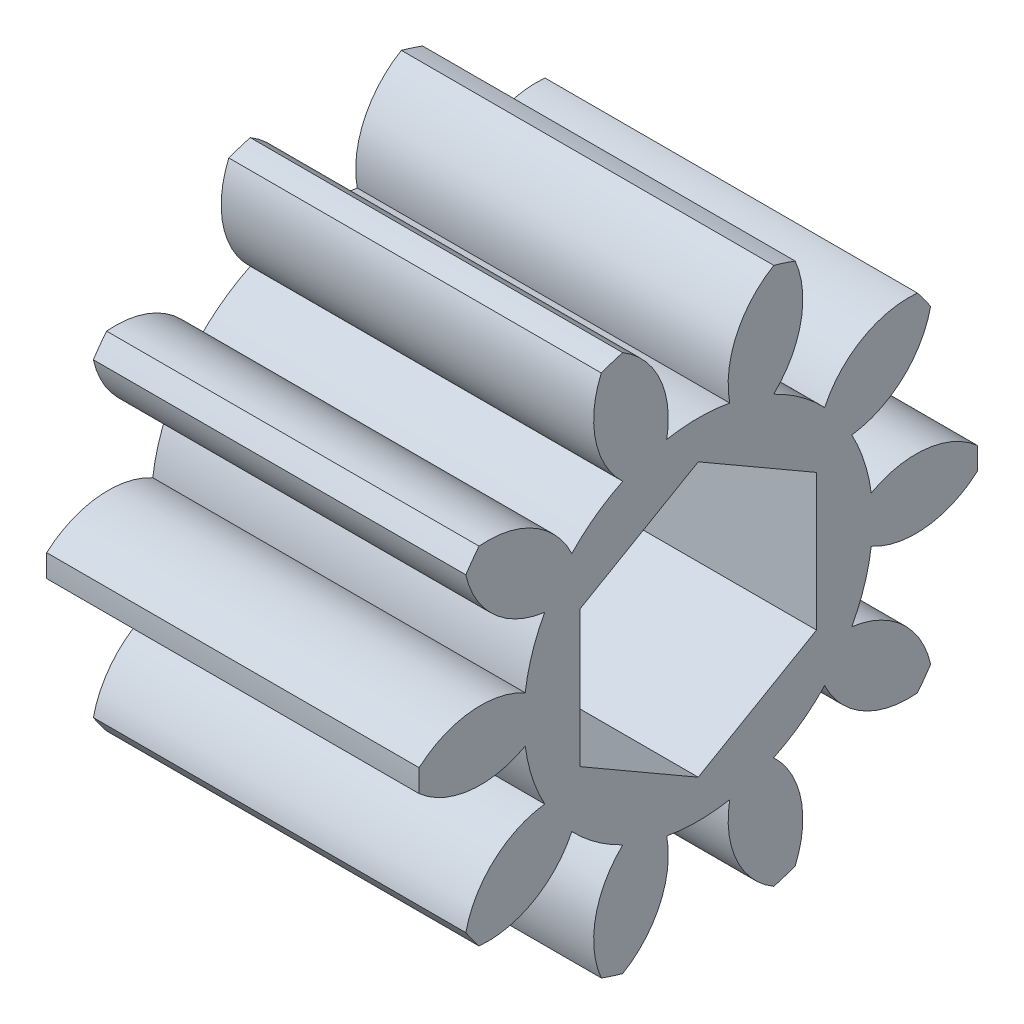
from build123d import *
from build123d.topology import SkipClean

# Parameters (mm, degrees)
BASPROSKE_W         = 14
BASPROSKE_H         = 15
TOOTHCUT_DEPTH      = 26.416530054
TEETHCUTS_COUNT     = 10
TEETHCUTS_ANGLE     = 324
BORSKE_R            = 5
BORE_DEPTH          = 50.0005588
CUT_EXTRUDE1_DEPTH  = 26.09062294
BOSS_EXTRUDE1_DEPTH = 6


with BuildPart() as part:
    # BasProSke → Base-Revolve (revolve)
    with BuildSketch(Plane(origin=(0, 0, 0), x_dir=(1, 0, 0), z_dir=(0, 1, 0)), mode=Mode.PRIVATE) as base_revolve_sk:
        with Locations((7, 7.5)):
            Rectangle(BASPROSKE_W, BASPROSKE_H)
    revolve(base_revolve_sk.sketch.rotate(Axis((-10, 0, 0), (1, 0, 0)), 180), axis=Axis((-10, 0, 0), (1, 0, 0)))

    # TooCutSke → ToothCut (cut, through all)
    with BuildSketch(Plane(origin=(0, 0, 0), x_dir=(0, 0, -1), z_dir=(1, 0, 0))):
        with BuildLine():
            ThreePointArc((1.691642647, 9.220098761), (0, 9.374), (-1.691642647, 9.220098761))
            ThreePointArc((-1.691642647, 9.220098761), (-2.059354944, 12.219114282), (-4.087513468, 14.458730194))
            ThreePointArc((-4.087513468, 14.458730194), (0, 15.0254), (4.087513468, 14.458730194))
            ThreePointArc((4.087513468, 14.458730194), (2.059354944, 12.219114282), (1.691642647, 9.220098761))
        make_face()
    toothcut = extrude(amount=TOOTHCUT_DEPTH, mode=Mode.SUBTRACT)

    # TeethCuts: ToothCut ×10 about axis
    teethcuts_axis = Axis((-10, 0, 0), (1, 0, 0))
    for i in range(1, TEETHCUTS_COUNT):
        add(toothcut.rotate(teethcuts_axis, i * TEETHCUTS_ANGLE / (TEETHCUTS_COUNT - 1)), mode=Mode.SUBTRACT)

    # BorSke → Bore (cut, symmetric)
    with BuildSketch(Plane(origin=(0, 0, 0), x_dir=(0, 0, -1), z_dir=(1, 0, 0))):
        with Locations(Location((0, 0, 0), (0, 0, 180))):
            Circle(BORSKE_R)
    extrude(amount=BORE_DEPTH, both=True, mode=Mode.SUBTRACT)

    # Sketch1 → Cut-Extrude1 (cut, through all)
    with BuildSketch(Plane(origin=(14, 0, 0), x_dir=(0, 0, -1), z_dir=(1, 0, 0))):
        Polygon((0, -7.332348419), (6.35, -3.666174209), (6.35, 3.666174209), (0, 7.332348419), (-6.35, 3.666174209), (-6.35, -3.666174209), align=None)
    extrude(amount=-CUT_EXTRUDE1_DEPTH, mode=Mode.SUBTRACT)

    # Sketch2 → Boss-Extrude1 (add)
    with SkipClean():  # the faces are left unmerged after this step: merging them gives an invalid solid
        with BuildSketch(Plane(origin=(14, 0, 0), x_dir=(0, 0, -1), z_dir=(1, 0, 0))):
            with BuildLine():
                ThreePointArc((14.987839303, -0.603881639), (15, 0), (14.987839303, 0.603881639))
                ThreePointArc((14.987839303, 0.603881639), (12.239957624, 1.819335924), (9.291581333, 1.240319444))
                ThreePointArc((9.291581333, 1.240319444), (8.915203784, 2.896725305), (8.246088681, 4.45801497))
                ThreePointArc((8.246088681, 4.45801497), (10.971712553, 5.7225929), (12.480369426, 8.321080397))
                ThreePointArc((12.480369426, 8.321080397), (12.135254916, 8.816778784), (11.770463983, 9.298181415))
                ThreePointArc((11.770463983, 9.298181415), (8.832954904, 8.666340261), (6.788005726, 6.464893987))
                ThreePointArc((6.788005726, 6.464893987), (5.509898955, 7.583725305), (4.050870426, 8.453539187))
                ThreePointArc((4.050870426, 8.453539187), (5.512646202, 11.078685739), (5.205822621, 14.067672545))
                ThreePointArc((5.205822621, 14.067672545), (4.635254916, 14.265847744), (4.057171486, 14.440891923))
                ThreePointArc((4.057171486, 14.440891923), (2.052063631, 12.203097177), (1.691642647, 9.220098761))
                ThreePointArc((1.691642647, 9.220098761), (0, 9.374), (-1.691642647, 9.220098761))
                ThreePointArc((-1.691642647, 9.220098761), (-2.052063631, 12.203097177), (-4.057171486, 14.440891923))
                ThreePointArc((-4.057171486, 14.440891923), (-4.635254916, 14.265847744), (-5.205822621, 14.067672545))
                ThreePointArc((-5.205822621, 14.067672545), (-5.512646202, 11.078685739), (-4.050870426, 8.453539187))
                ThreePointArc((-4.050870426, 8.453539187), (-5.509898955, 7.583725305), (-6.788005726, 6.464893987))
                ThreePointArc((-6.788005726, 6.464893987), (-8.832954904, 8.666340261), (-11.770463983, 9.298181415))
                ThreePointArc((-11.770463983, 9.298181415), (-12.135254916, 8.816778784), (-12.480369426, 8.321080397))
                ThreePointArc((-12.480369426, 8.321080397), (-10.971712553, 5.7225929), (-8.246088681, 4.45801497))
                ThreePointArc((-8.246088681, 4.45801497), (-8.915203784, 2.896725305), (-9.291581333, 1.240319444))
                ThreePointArc((-9.291581333, 1.240319444), (-12.239957624, 1.819335924), (-14.987839303, 0.603881639))
                ThreePointArc((-14.987839303, 0.603881639), (-15, 0), (-14.987839303, -0.603881639))
                ThreePointArc((-14.987839303, -0.603881639), (-12.239957624, -1.819335924), (-9.291581333, -1.240319444))
                ThreePointArc((-9.291581333, -1.240319444), (-8.915203784, -2.896725305), (-8.246088681, -4.45801497))
                ThreePointArc((-8.246088681, -4.45801497), (-10.971712553, -5.7225929), (-12.480369426, -8.321080397))
                ThreePointArc((-12.480369426, -8.321080397), (-12.135254916, -8.816778784), (-11.770463983, -9.298181415))
                ThreePointArc((-11.770463983, -9.298181415), (-8.832954904, -8.666340261), (-6.788005726, -6.464893987))
                ThreePointArc((-6.788005726, -6.464893987), (-5.509898955, -7.583725305), (-4.050870426, -8.453539187))
                ThreePointArc((-4.050870426, -8.453539187), (-5.512646202, -11.078685739), (-5.205822621, -14.067672545))
                ThreePointArc((-5.205822621, -14.067672545), (-4.635254916, -14.265847744), (-4.057171486, -14.440891923))
                ThreePointArc((-4.057171486, -14.440891923), (-2.052063631, -12.203097177), (-1.691642647, -9.220098761))
                ThreePointArc((-1.691642647, -9.220098761), (0, -9.374), (1.691642647, -9.220098761))
                ThreePointArc((1.691642647, -9.220098761), (2.052063631, -12.203097177), (4.057171486, -14.440891923))
                ThreePointArc((4.057171486, -14.440891923), (4.635254916, -14.265847744), (5.205822621, -14.067672545))
                ThreePointArc((5.205822621, -14.067672545), (5.512646202, -11.078685739), (4.050870426, -8.453539187))
                ThreePointArc((4.050870426, -8.453539187), (5.509898955, -7.583725305), (6.788005726, -6.464893987))
                ThreePointArc((6.788005726, -6.464893987), (8.832954904, -8.666340261), (11.770463983, -9.298181415))
                ThreePointArc((11.770463983, -9.298181415), (12.135254916, -8.816778784), (12.480369426, -8.321080397))
                ThreePointArc((12.480369426, -8.321080397), (10.971712553, -5.7225929), (8.246088681, -4.45801497))
                ThreePointArc((8.246088681, -4.45801497), (8.915203784, -2.896725305), (9.291581333, -1.240319444))
                ThreePointArc((9.291581333, -1.240319444), (12.239957624, -1.819335924), (14.987839303, -0.603881639))
            make_face()
            Polygon((-6.35, -3.666174209), (0, -7.332348419), (6.35, -3.666174209), (6.35, 3.666174209), (0, 7.332348419), (-6.35, 3.666174209), align=None, mode=Mode.SUBTRACT)
        extrude(amount=BOSS_EXTRUDE1_DEPTH)


solid = part.part
